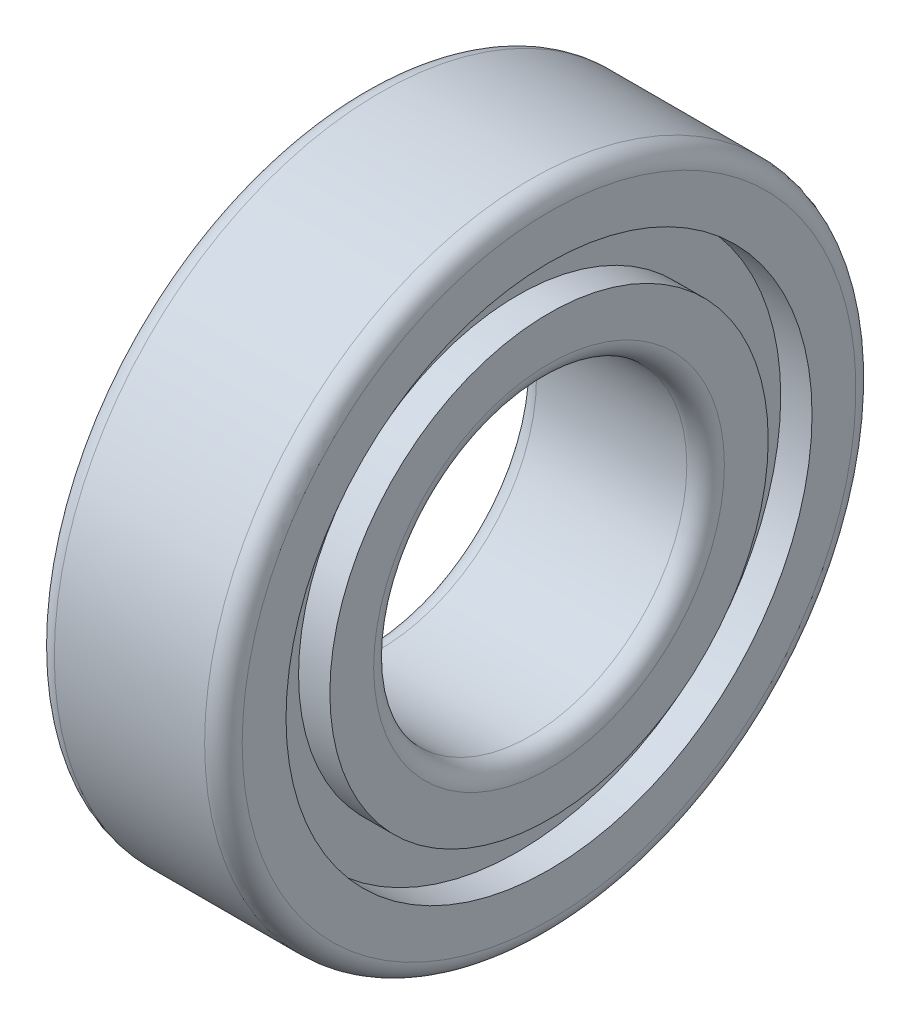
from build123d import *


with BuildPart() as part:
    # Эскиз1 → Повернуть1 (revolve)
    with BuildSketch(Plane.XY, mode=Mode.PRIVATE) as revolve_1_sk:
        with BuildLine():
            Line((6, 12.5), (-6, 12.5))
            ThreePointArc((-6, 12.5), (-7.060660172, 12.939339828), (-7.5, 14))
            Line((-7.5, 14), (-7.5, 17.5))
            Line((-7.5, 17.5), (-5, 17.5))
            Line((-5, 17.5), (-5, 21))
            Line((-5, 21), (-7.5, 21))
            Line((-7.5, 21), (-7.5, 24.5))
            ThreePointArc((-7.5, 24.5), (-7.060660172, 25.560660172), (-6, 26))
            Line((-6, 26), (6, 26))
            ThreePointArc((6, 26), (7.060660172, 25.560660172), (7.5, 24.5))
            Line((7.5, 24.5), (7.5, 21))
            Line((7.5, 21), (5, 21))
            Line((5, 21), (5, 17.5))
            Line((5, 17.5), (7.5, 17.5))
            Line((7.5, 17.5), (7.5, 14))
            ThreePointArc((7.5, 14), (7.060660172, 12.939339828), (6, 12.5))
        make_face()
    revolve(revolve_1_sk.sketch.rotate(Axis((-1000, 0, 0), (1, 0, 0)), 90), axis=Axis((-1000, 0, 0), (1, 0, 0)))


solid = part.part
